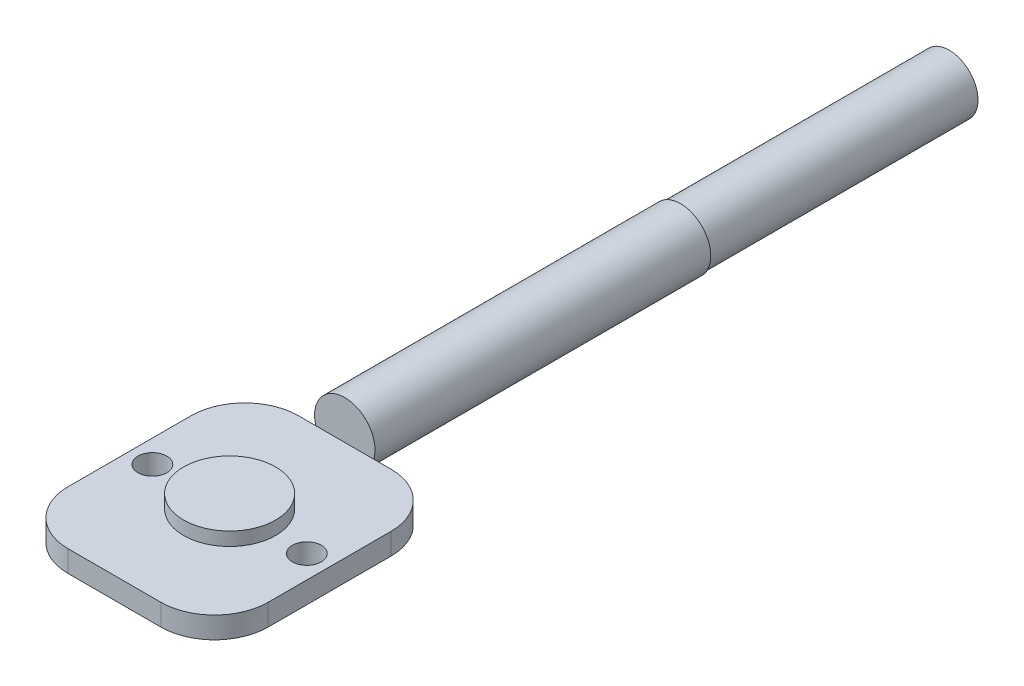
from build123d import *

# Parameters (mm, degrees)
SKETCH1_R           = 1.075
BOSS_EXTRUDE1_DEPTH = 1.6
SKETCH2_R           = 3.426475787
BOSS_EXTRUDE2_DEPTH = 1
SKETCH4_R           = 2.25
BOSS_EXTRUDE3_DEPTH = 25
SKETCH5_R           = 2.15
BOSS_EXTRUDE4_DEPTH = 20


with BuildPart() as part:
    # Sketch1 → Boss-Extrude1 (new body)
    with BuildSketch(Plane(origin=(0, 0, 0), x_dir=(1, 0, 0), z_dir=(0, 1, 0))):
        with BuildLine():
            Line((-3.45, 8.575), (3.45, 8.575))
            ThreePointArc((3.45, 8.575), (6.278427125, 7.403427125), (7.45, 4.575))
            Line((7.45, 4.575), (7.45, -4.575))
            ThreePointArc((7.45, -4.575), (6.278427125, -7.403427125), (3.45, -8.575))
            Line((3.45, -8.575), (-3.45, -8.575))
            ThreePointArc((-3.45, -8.575), (-6.278427125, -7.403427125), (-7.45, -4.575))
            Line((-7.45, -4.575), (-7.45, 4.575))
            ThreePointArc((-7.45, 4.575), (-6.278427125, 7.403427125), (-3.45, 8.575))
        make_face()
        with Locations(Location((-5.75, 0, 0), (0, 0, 270))):
            Circle(SKETCH1_R, mode=Mode.SUBTRACT)
        with Locations(Location((5.75, 0, 0), (0, 0, 270))):
            Circle(SKETCH1_R, mode=Mode.SUBTRACT)
    extrude(amount=BOSS_EXTRUDE1_DEPTH)

    # Sketch2 → Boss-Extrude2 (add)
    with BuildSketch(Plane(origin=(0, 1.6, 0), x_dir=(1, 0, 0), z_dir=(0, 1, 0))):
        with Locations(Location((0, 0, 0), (0, 0, 270))):
            Circle(SKETCH2_R)
    extrude(amount=BOSS_EXTRUDE2_DEPTH)


with BuildPart() as body_2:
    # Sketch4 → Boss-Extrude3 (new body)
    with BuildSketch(Plane(origin=(0, 0, -8.575), x_dir=(-1, 0, 0), z_dir=(0, 0, -1))):
        with Locations((0, 2.25)):
            Circle(SKETCH4_R)
    extrude(amount=BOSS_EXTRUDE3_DEPTH)

    # Sketch5 → Boss-Extrude4 (add)
    with BuildSketch(Plane(origin=(0, 0, -33.575), x_dir=(-1, 0, 0), z_dir=(0, 0, -1))):
        with Locations((0, 2.25)):
            Circle(SKETCH5_R)
    extrude(amount=BOSS_EXTRUDE4_DEPTH)


solid = Compound([part.part, body_2.part])
